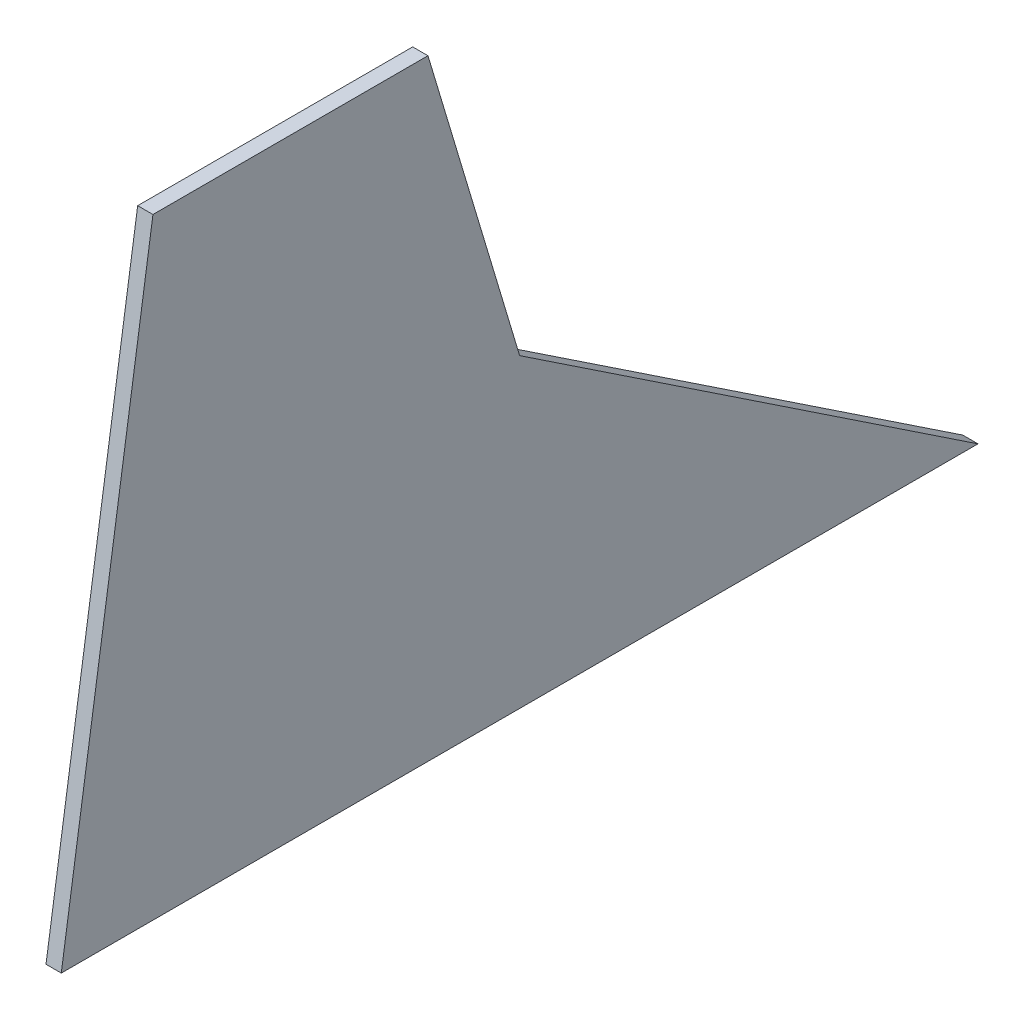
from build123d import *

# Parameters (mm, degrees)
EXTRUDE_2_DEPTH = 5


with BuildPart() as part:
    # 草图1 → 拉伸2 (new body)
    with BuildSketch(Plane(origin=(0, 0, 0), x_dir=(0, 0, -1), z_dir=(1, 0, 0))):
        Polygon((-30, 200), (-60, 0), (120, 0), (90, 100), (60, 200), align=None)
        Polygon((90, 100), (120, 0), (240, 0), align=None)
    extrude(amount=EXTRUDE_2_DEPTH)


solid = part.part
